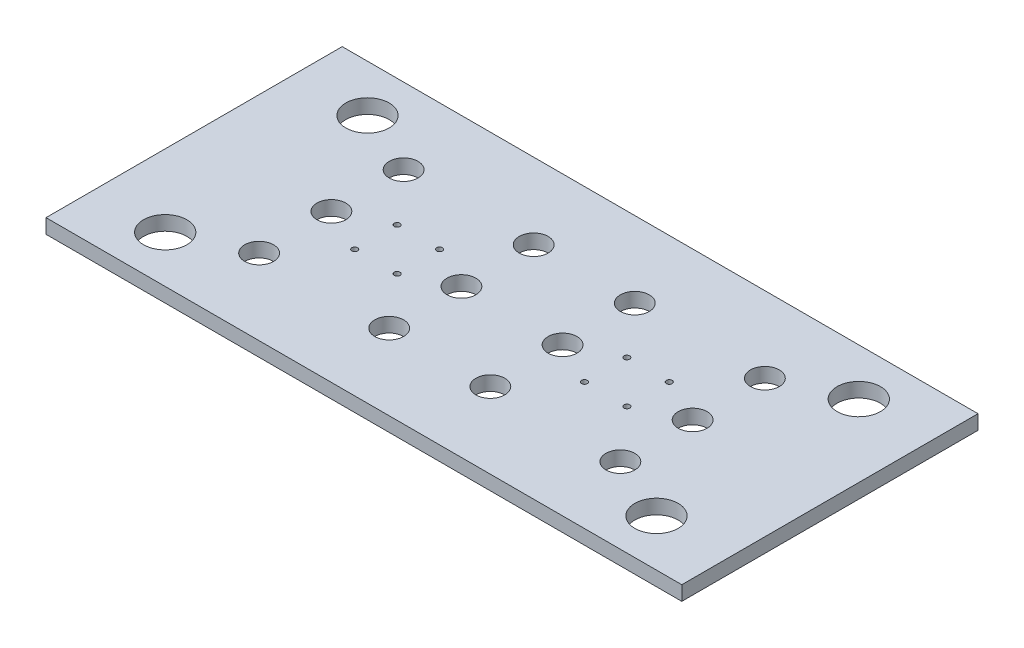
from build123d import *

# Parameters (mm, degrees)
SKETCH1_W           = 880
SKETCH1_H           = 410
BOSS_EXTRUDE1_DEPTH = 20
SKETCH3_R           = 30
CUT_EXTRUDE1_DEPTH  = 142
SKETCH4_R           = 4
CUT_EXTRUDE2_DEPTH  = 136
SKETCH5_R           = 6
CUT_EXTRUDE3_DEPTH  = 6
SKETCH7_R           = 20
CUT_EXTRUDE4_DEPTH  = 261


with BuildPart() as part:
    # Sketch1 → Boss-Extrude1 (new body)
    with BuildSketch(Plane(origin=(0, 0, 0), x_dir=(1, 0, 0), z_dir=(0, 1, 0))):
        Rectangle(SKETCH1_W, SKETCH1_H)
    extrude(amount=BOSS_EXTRUDE1_DEPTH)

    # Sketch3 → Cut-Extrude1 (cut)
    with BuildSketch(Plane(origin=(0, 20, 0), x_dir=(1, 0, 0), z_dir=(0, 1, 0))):
        with Locations(Location((-340, 140, 0), (0, 0, 270))):
            Circle(SKETCH3_R)
        with Locations(Location((340, 140, 0), (0, 0, 270))):
            Circle(SKETCH3_R)
        with Locations(Location((340, -140, 0), (0, 0, 270))):
            Circle(SKETCH3_R)
        with Locations(Location((-340, -140, 0), (0, 0, 270))):
            Circle(SKETCH3_R)
    extrude(amount=-CUT_EXTRUDE1_DEPTH, mode=Mode.SUBTRACT)

    # Sketch4 → Cut-Extrude2 (cut)
    with BuildSketch(Plane(origin=(0, 20, 0), x_dir=(1, 0, 0), z_dir=(0, 1, 0))):
        with Locations(Location((-129.655068581, 29.344931419, 0), (0, 0, 270))):
            Circle(SKETCH4_R)
        with Locations(Location((-129.655068581, -29.344931419, 0), (0, 0, 270))):
            Circle(SKETCH4_R)
        with Locations(Location((-188.344931419, -29.344931419, 0), (0, 0, 270))):
            Circle(SKETCH4_R)
        with Locations(Location((-188.344931419, 29.344931419, 0), (0, 0, 270))):
            Circle(SKETCH4_R)
        with Locations(Location((188.344931419, 29.344931419, 0), (0, 0, 270))):
            Circle(SKETCH4_R)
        with Locations(Location((188.344931419, -29.344931419, 0), (0, 0, 270))):
            Circle(SKETCH4_R)
        with Locations(Location((129.655068581, -29.344931419, 0), (0, 0, 270))):
            Circle(SKETCH4_R)
        with Locations(Location((129.655068581, 29.344931419, 0), (0, 0, 270))):
            Circle(SKETCH4_R)
    extrude(amount=-CUT_EXTRUDE2_DEPTH, mode=Mode.SUBTRACT)

    # Sketch5 → Cut-Extrude3 (cut)
    with BuildSketch(Plane.XZ):
        with Locations(Location((-188.344931419, 29.344931419, 0), (0, 0, 270))):
            Circle(SKETCH5_R)
        with Locations(Location((-129.655068581, 29.344931419, 0), (0, 0, 270))):
            Circle(SKETCH5_R)
        with Locations(Location((-129.655068581, -29.344931419, 0), (0, 0, 270))):
            Circle(SKETCH5_R)
        with Locations(Location((-188.344931419, -29.344931419, 0), (0, 0, 270))):
            Circle(SKETCH5_R)
    cut_extrude3 = extrude(amount=-CUT_EXTRUDE3_DEPTH, mode=Mode.SUBTRACT)

    # Mirror1: Cut-Extrude3 across plane
    add(cut_extrude3.mirror(Plane(origin=(0, 0, 0), x_dir=(0, 0, 1), z_dir=(1, 0, 0))), mode=Mode.SUBTRACT)

    # Sketch7 → Cut-Extrude4 (cut)
    with BuildSketch(Plane.XZ):
        with Locations(Location((-250, 0, 0), (0, 0, 270))):
            Circle(SKETCH7_R)
        with Locations(Location((-250, 100, 0), (0, 0, 270))):
            Circle(SKETCH7_R)
        with Locations(Location((-250, -100, 0), (0, 0, 270))):
            Circle(SKETCH7_R)
        with Locations(Location((-70, 100, 0), (0, 0, 270))):
            Circle(SKETCH7_R)
        with Locations(Location((-70, 0, 0), (0, 0, 270))):
            Circle(SKETCH7_R)
        with Locations(Location((-70, -100, 0), (0, 0, 270))):
            Circle(SKETCH7_R)
        with Locations(Location((70, -100, 0), (0, 0, 90))):
            Circle(SKETCH7_R)
        with Locations(Location((70, 0, 0), (0, 0, 90))):
            Circle(SKETCH7_R)
        with Locations(Location((70, 100, 0), (0, 0, 90))):
            Circle(SKETCH7_R)
        with Locations(Location((250, -100, 0), (0, 0, 90))):
            Circle(SKETCH7_R)
        with Locations(Location((250, 100, 0), (0, 0, 90))):
            Circle(SKETCH7_R)
        with Locations(Location((250, 0, 0), (0, 0, 90))):
            Circle(SKETCH7_R)
    extrude(amount=-CUT_EXTRUDE4_DEPTH, mode=Mode.SUBTRACT)


solid = part.part
